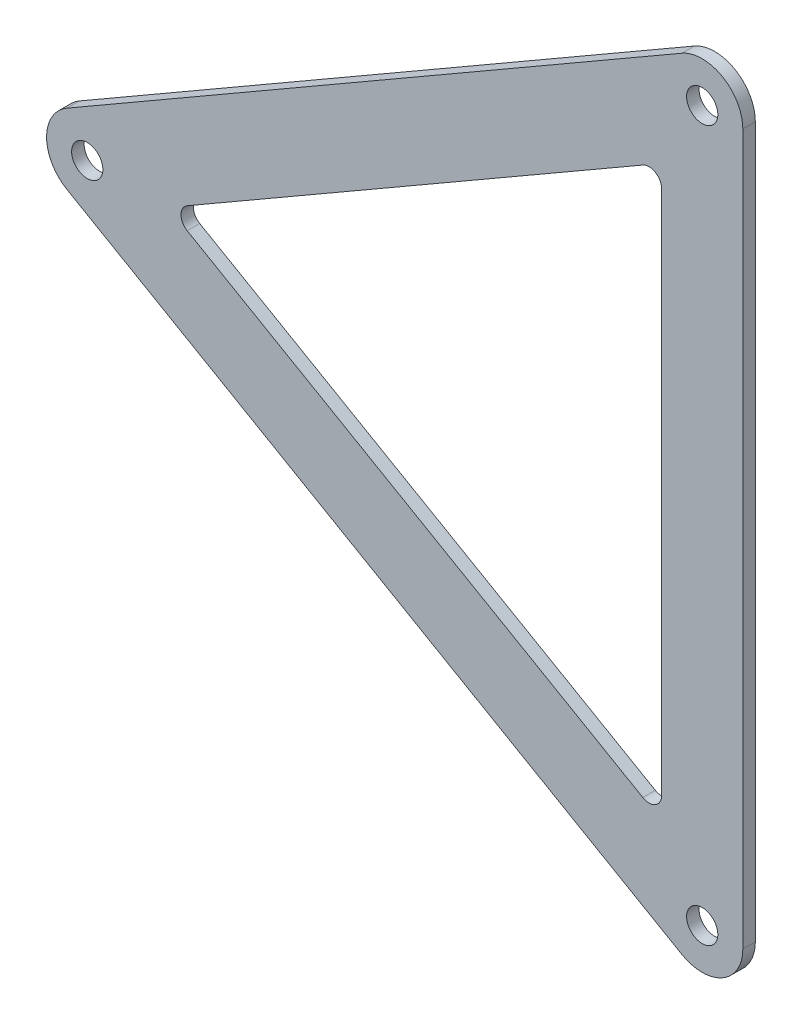
from build123d import *

# Parameters (mm, degrees)
SKETCH1_R           = 2.5
BOSS_EXTRUDE1_DEPTH = 2


with BuildPart() as part:
    # Sketch1 → Boss-Extrude1 (new body)
    with BuildSketch(Plane.XY):
        with BuildLine():
            Line((245.25, -5.629165125), (343.630404909, -62.429118382))
            ThreePointArc((343.630404909, -62.429118382), (350.130404909, -62.429118382), (353.380404909, -56.799953257))
            Line((353.380404909, -56.799953257), (353.380404909, 56.799953257))
            ThreePointArc((353.380404909, 56.799953257), (350.130404909, 62.429118382), (343.630404909, 62.429118382))
            Line((343.630404909, 62.429118382), (245.25, 5.629165125))
            ThreePointArc((245.25, 5.629165125), (242, 0), (245.25, -5.629165125))
        make_face()
        with Locations((248.5, 0)):
            Circle(SKETCH1_R, mode=Mode.SUBTRACT)
        with Locations((346.880404909, -56.799953257)):
            Circle(SKETCH1_R, mode=Mode.SUBTRACT)
        with Locations((346.880404909, 56.799953257)):
            Circle(SKETCH1_R, mode=Mode.SUBTRACT)
        with BuildLine():
            Line((264.5, 1.732050808), (337.380404909, 43.809572201))
            ThreePointArc((337.380404909, 43.809572201), (339.380404909, 43.809572201), (340.380404909, 42.077521393))
            Line((340.380404909, 42.077521393), (340.380404909, -42.077521393))
            ThreePointArc((340.380404909, -42.077521393), (339.380404909, -43.809572201), (337.380404909, -43.809572201))
            Line((337.380404909, -43.809572201), (264.5, -1.732050808))
            ThreePointArc((264.5, -1.732050808), (263.5, 0), (264.5, 1.732050808))
        make_face(mode=Mode.SUBTRACT)
    extrude(amount=BOSS_EXTRUDE1_DEPTH)


solid = part.part
